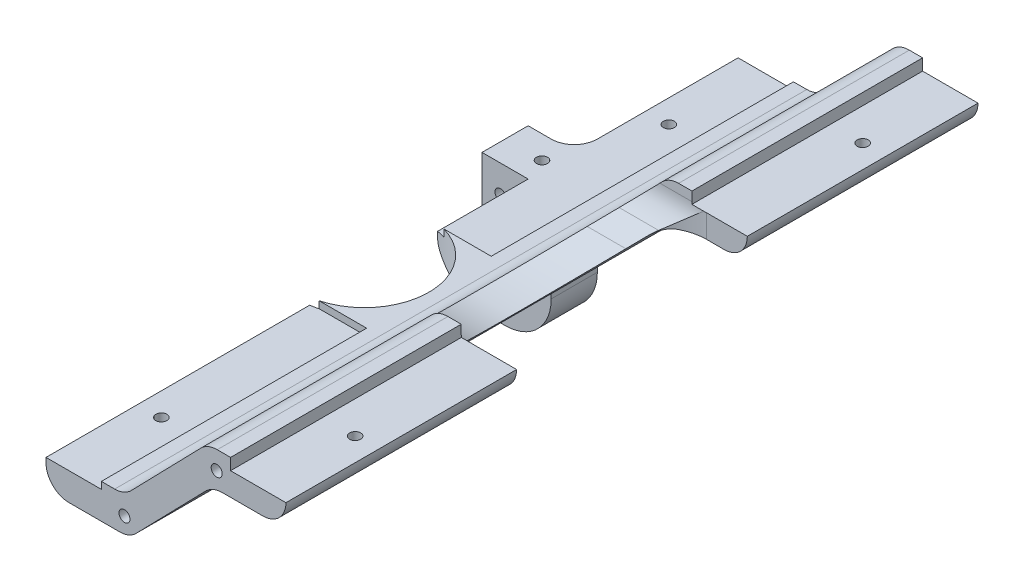
from build123d import *

# Parameters (mm, degrees)
BOSS_EXTRU_1_DEPTH      = 75
CONG_1_R                = 5
ESQUISSE2_W             = 12
ESQUISSE2_H             = 27
BOSS_EXTRU_2_DEPTH      = 1.5
ESQUISSE3_R             = 14
ENL_V_MAT_EXTRU_1_DEPTH = 87.989941947
ENL_V_MAT_EXTRU_2_DEPTH = 94.429117653
ENL_V_MAT_EXTRU_3_DEPTH = 89.887569593
ESQUISSE6_R             = 1.2
ENL_V_MAT_EXTRU_4_DEPTH = 20
ESQUISSE7_R             = 1.2
ENL_V_MAT_EXTRU_5_DEPTH = 89.46044325
ESQUISSE9_W             = 15
ESQUISSE9_H             = 10
BOSS_EXTRU_3_DEPTH      = 30
CONG_2_R                = 10
CONG_3_R                = 5
ESQUISSE10_R            = 1.2
ENL_V_MAT_EXTRU_6_DEPTH = 10
ESQUISSE11_R            = 1.2
ENL_V_MAT_EXTRU_7_DEPTH = 15
ESQUISSE12_W            = 12
ESQUISSE12_H            = 2.5
ENL_V_MAT_EXTRU_8_DEPTH = 159.113883129


with BuildPart() as part:
    # Esquisse1 → Boss.-Extru.1 (new, symmetric)
    with BuildSketch(Plane.XY):
        Polygon((-12, 0), (0, 0), (0, 1.5), (5, 1.5), (23, 20), (28, 20), (28, 18.5), (40, 18.5), (40, 12.5), (24.074103459, 12.5), (6.074103459, -6), (-12, -6), align=None)
    extrude(amount=BOSS_EXTRU_1_DEPTH, both=True)

    # Congé1
    cong_1_edges = [part.edges().sort_by_distance(p)[0] for p in [
        (5, 1.5, 0),
        (23, 20, 0),
        (40, 12.5, 0),
        (24.074103459, 12.5, 0),
        (6.074103459, -6, 0),
        (-12, -6, 0),
    ]]
    fillet(cong_1_edges, radius=CONG_1_R)

    # Esquisse2 → Boss.-Extru.2 (add)
    with BuildSketch(Plane(origin=(0, 0, 0), x_dir=(1, 0, 0), z_dir=(0, 1, 0))):
        with Locations((-6, -4)):
            Rectangle(ESQUISSE2_W, ESQUISSE2_H)
    extrude(amount=BOSS_EXTRU_2_DEPTH)

    # Esquisse3 → Enlèv. mat.-Extru.1 (cut, through all)
    with BuildSketch(Plane(origin=(0, 1.5, 0), x_dir=(1, 0, 0), z_dir=(0, 1, 0))):
        with Locations((-14, -4)):
            Circle(ESQUISSE3_R)
    extrude(amount=-ENL_V_MAT_EXTRU_1_DEPTH, mode=Mode.SUBTRACT)

    # Esquisse4 → Enlèv. mat.-Extru.2 (cut, through all)
    with BuildSketch(Plane(origin=(40, 0, 0), x_dir=(0, 0, -1), z_dir=(1, 0, 0))):
        with BuildLine():
            Line((-22, 12), (-18, 9))
            ThreePointArc((-18, 9), (0, 3), (18, 9))
            Line((18, 9), (22, 12))
            ThreePointArc((22, 12), (24.208203932, 14.645898034), (25, 18))
            Line((25, 18), (25, 20))
            Line((25, 20), (-25, 20))
            Line((-25, 20), (-25, 18))
            ThreePointArc((-25, 18), (-24.208203932, 14.645898034), (-22, 12))
        make_face()
    extrude(amount=-ENL_V_MAT_EXTRU_2_DEPTH, mode=Mode.SUBTRACT)

    # Esquisse5 → Enlèv. mat.-Extru.3 (cut, through all)
    with BuildSketch(Plane(origin=(0, 20, 0), x_dir=(1, 0, 0), z_dir=(0, 1, 0))):
        with BuildLine():
            Line((40, 25), (31.163059803, 25))
            ThreePointArc((31.163059803, 25), (26.361328616, 23.849850491), (22.601776236, 20.649033065))
            Line((22.601776236, 20.649033065), (22.601776236, -20.649033065))
            ThreePointArc((22.601776236, -20.649033065), (26.361328616, -23.849850491), (31.163059803, -25))
            Line((31.163059803, -25), (40, -25))
            Line((40, -25), (40, 25))
        make_face()
    extrude(amount=-ENL_V_MAT_EXTRU_3_DEPTH, mode=Mode.SUBTRACT)

    # Esquisse6 → Enlèv. mat.-Extru.4 (cut)
    with BuildSketch(Plane.XY.offset(75)):
        with Locations((25, 16)):
            Circle(ESQUISSE6_R)
        with Locations((5, -2.5)):
            Circle(ESQUISSE6_R)
    enl_v_mat_extru_4 = extrude(amount=-ENL_V_MAT_EXTRU_4_DEPTH, mode=Mode.SUBTRACT)

    # Esquisse7 → Enlèv. mat.-Extru.5 (cut, through all)
    with BuildSketch(Plane(origin=(0, 18.5, 0), x_dir=(1, 0, 0), z_dir=(0, 1, 0))):
        with Locations(Location((35, -55, 0), (0, 0, 180))):
            Circle(ESQUISSE7_R)
        with Locations(Location((-7, -55, 0), (0, 0, 90))):
            Circle(ESQUISSE7_R)
    enl_v_mat_extru_5 = extrude(amount=-ENL_V_MAT_EXTRU_5_DEPTH, mode=Mode.SUBTRACT)

    # Symétrie1: Enlèv. mat.-Extru.4, Enlèv. mat.-Extru.5 across plane
    add(enl_v_mat_extru_4.mirror(Plane.XY), mode=Mode.SUBTRACT)
    add(enl_v_mat_extru_5.mirror(Plane.XY), mode=Mode.SUBTRACT)

    # Esquisse9 → Boss.-Extru.3 (add)
    with BuildSketch(Plane(origin=(0, 0, 0), x_dir=(1, 0, 0), z_dir=(0, 1, 0))):
        with Locations((-14.5, 34.5)):
            Rectangle(ESQUISSE9_W, ESQUISSE9_H)
    extrude(amount=-BOSS_EXTRU_3_DEPTH)

    # Congé2
    cong_2_edges = [part.edges().sort_by_distance(p)[0] for p in [
        (-7, -6, -34.5),
        (-7, -30, -34.5),
    ]]
    fillet(cong_2_edges, radius=CONG_2_R)

    # Congé3
    cong_3_edges = [part.edges().sort_by_distance(p)[0] for p in [
        (-12, -0.5, -39.5),
        (-10.535533906, -4.535533906, -39.5),
        (-2, -6, -39.5),
    ]]
    fillet(cong_3_edges, radius=CONG_3_R)

    # Esquisse10 → Enlèv. mat.-Extru.6 (cut)
    with BuildSketch(Plane.XY.offset(-29.5)):
        with Locations((-18, -24)):
            Circle(ESQUISSE10_R)
        with Locations((-18, -6)):
            Circle(ESQUISSE10_R)
    extrude(amount=-ENL_V_MAT_EXTRU_6_DEPTH, mode=Mode.SUBTRACT)

    # Esquisse11 → Enlèv. mat.-Extru.7 (cut)
    with BuildSketch(Plane(origin=(0, 0, 0), x_dir=(1, 0, 0), z_dir=(0, 1, 0))):
        with Locations(Location((-14, 34.5, 0), (0, 0, 270))):
            Circle(ESQUISSE11_R)
    extrude(amount=-ENL_V_MAT_EXTRU_7_DEPTH, mode=Mode.SUBTRACT)

    # Esquisse12 → Enlèv. mat.-Extru.8 (cut, through all)
    with BuildSketch(Plane.XY.offset(75)):
        with Locations((34, 18.75)):
            Rectangle(ESQUISSE12_W, ESQUISSE12_H)
    extrude(amount=-ENL_V_MAT_EXTRU_8_DEPTH, mode=Mode.SUBTRACT)


solid = part.part
